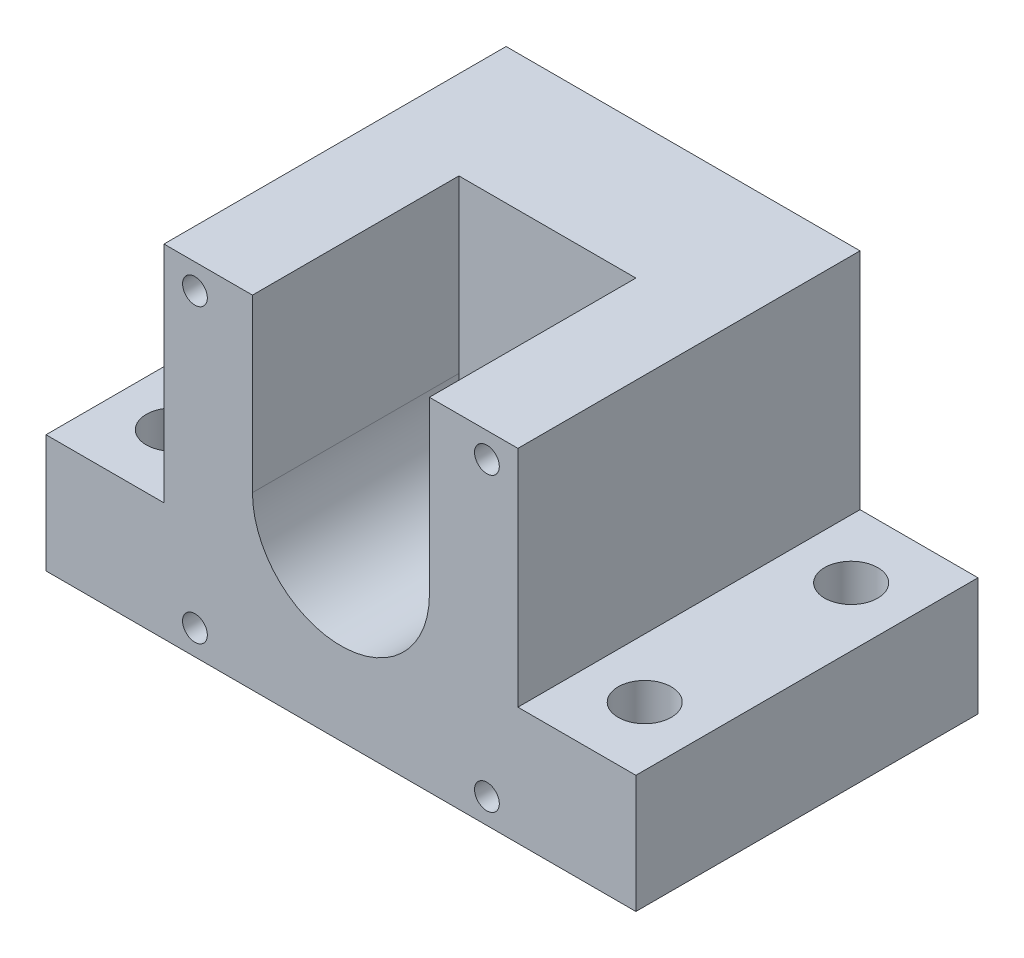
from build123d import *

# Parameters (mm, degrees)
BOSS_EXTRUDE1_DEPTH  = 58
SKETCH3_R            = 11
CUT_EXTRUDE1_DEPTH   = 13
SKETCH4_R            = 8
CUT_EXTRUDE2_DEPTH   = 89.820042783
SKETCH5_R            = 15
CUT_EXTRUDE3_DEPTH   = 35
SKETCH6_W            = 30
SKETCH6_H            = 29
CUT_EXTRUDE4_DEPTH   = 35
M5_TAPPED_HOLE1_D    = 4.2
SKETCH12_W           = 20
SKETCH12_H           = 58
CUT_EXTRUDE6_DEPTH   = 38
M8_CLEARANCE_HOLE1_D = 9


with BuildPart() as part:
    # Sketch2 → Boss-Extrude1 (new body)
    with BuildSketch(Plane(origin=(0, 0, 0), x_dir=(1, 0, 0), z_dir=(0, 1, 0))):
        Polygon((-50, 0), (0, 0), (50, 0), (50, 58), (-50, 58), align=None)
    extrude(amount=BOSS_EXTRUDE1_DEPTH)

    # Sketch3 → Cut-Extrude1 (cut)
    with BuildSketch(Plane.XY.offset(-58)):
        with Locations(Location((0, 29, 0), (0, 0, 180))):
            Circle(SKETCH3_R)
    extrude(amount=CUT_EXTRUDE1_DEPTH, mode=Mode.SUBTRACT)

    # Sketch4 → Cut-Extrude2 (cut, through all)
    with BuildSketch(Plane(origin=(0, 0, -45), x_dir=(-1, 0, 0), z_dir=(0, 0, -1))):
        with Locations((0, 29)):
            Circle(SKETCH4_R)
    extrude(amount=-CUT_EXTRUDE2_DEPTH, mode=Mode.SUBTRACT)

    # Sketch5 → Cut-Extrude3 (cut)
    with BuildSketch(Plane.XY):
        with Locations((0, 29)):
            Circle(SKETCH5_R)
    extrude(amount=-CUT_EXTRUDE3_DEPTH, mode=Mode.SUBTRACT)

    # Sketch6 → Cut-Extrude4 (cut)
    with BuildSketch(Plane.XY):
        with Locations((0, 43.5)):
            Rectangle(SKETCH6_W, SKETCH6_H)
    extrude(amount=-CUT_EXTRUDE4_DEPTH, mode=Mode.SUBTRACT)

    # M5 Tapped Hole1 (through all)
    with Locations(Plane(origin=(8.704435936, 17.394887918, 0), x_dir=(1, 0, 0), z_dir=(0, 0, 1))):
        with Locations((16.044301406, 36.353849424), (-33.453173277, 36.353849424), (-33.453173277, -13.143625259), (16.044301406, -13.143625259)):
            Hole(M5_TAPPED_HOLE1_D / 2)

    # Sketch12 → Cut-Extrude6 (cut)
    with BuildSketch(Plane(origin=(0, 58, 0), x_dir=(1, 0, 0), z_dir=(0, 1, 0))):
        with Locations((-40, 29)):
            Rectangle(SKETCH12_W, SKETCH12_H)
        with Locations((40, 29)):
            Rectangle(SKETCH12_W, SKETCH12_H)
    extrude(amount=-CUT_EXTRUDE6_DEPTH, mode=Mode.SUBTRACT)

    # M8 Clearance Hole1 (through all)
    with Locations(Plane(origin=(8.704435936, 20, -505.336111538), x_dir=(1, 0, 0), z_dir=(0, 1, 0))):
        with Locations((-48.704435936, -458.836111538), (-48.704435936, -493.836111538), (31.295564064, -458.836111538), (31.295564064, -493.836111538), (-48.704435936, 58.078352635), (31.295564064, 58.078352635)):
            Hole(M8_CLEARANCE_HOLE1_D / 2)


solid = part.part
